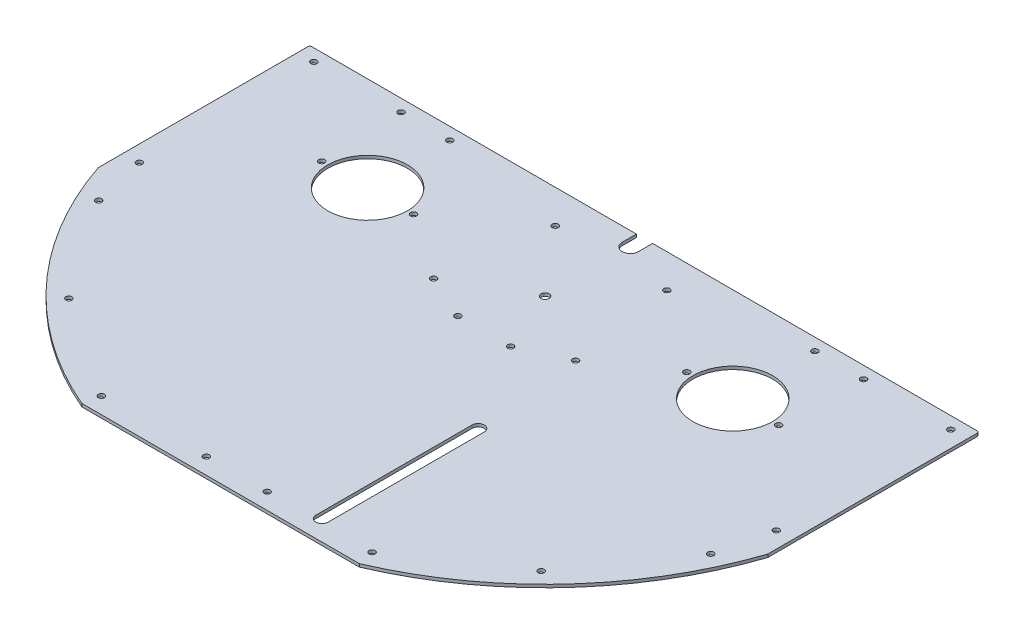
from build123d import *

# Parameters (mm, degrees)
BOSS_EXTRU_1_DEPTH      = 1.5
ESQUISSE7_R             = 1.5
ENL_V_MAT_EXTRU_5_DEPTH = 230.841793415
ESQUISSE8_R             = 19.627416998
ESQUISSE8_R_2           = 1.5
ENL_V_MAT_EXTRU_6_DEPTH = 230.841793415
ESQUISSE9_R             = 1.5
ESQUISSE9_R_2           = 2
ENL_V_MAT_EXTRU_7_DEPTH = 230.841793415
ENL_V_MAT_EXTRU_8_DEPTH = 230.841793415
CONG_1_R                = 1
ESQUISSE11_R            = 1.5
ENL_V_MAT_EXTRU_9_DEPTH = 230.841793415


with BuildPart() as part:
    # Esquisse1 → Boss.-Extru.1 (new body)
    with BuildSketch(Plane(origin=(0, 0, 0), x_dir=(1, 0, 0), z_dir=(0, 1, 0))):
        with BuildLine():
            Line((0, 49), (165, 49))
            Line((165, 49), (165, -55.235857919))
            ThreePointArc((165, -55.235857919), (127.908511428, -117.963607542), (68.381283989, -160))
            Line((68.381283989, -160), (0, -160))
            Line((0, -160), (0, 49))
        make_face()
    extrude(amount=BOSS_EXTRU_1_DEPTH)

    # Symétrie1: part across plane


with BuildPart() as part_1:
    add(part.part)
    add(part.part.mirror(Plane(origin=(0, 1.5, -49), x_dir=(0, 0, 1), z_dir=(1, 0, 0))))

    # Esquisse7 → Enlèv. mat.-Extru.5 (cut, through all)
    with BuildSketch(Plane(origin=(0, 1.5, 0), x_dir=(1, 0, 0), z_dir=(0, 1, 0))):
        with Locations(Location((-157, -43, 0), (0, 0, 270))):
            Circle(ESQUISSE7_R)
        with Locations(Location((157, -43, 0), (0, 0, 270))):
            Circle(ESQUISSE7_R)
        with Locations(Location((157, 43, 0), (0, 0, 270))):
            Circle(ESQUISSE7_R)
        with Locations(Location((-157, 43, 0), (0, 0, 270))):
            Circle(ESQUISSE7_R)
        with Locations(Location((-114, 43, 0), (0, 0, 270))):
            Circle(ESQUISSE7_R)
        with Locations(Location((-90, 43, 0), (0, 0, 270))):
            Circle(ESQUISSE7_R)
        with Locations(Location((90, 43, 0), (0, 0, 90))):
            Circle(ESQUISSE7_R)
        with Locations(Location((114, 43, 0), (0, 0, 90))):
            Circle(ESQUISSE7_R)
    extrude(amount=-ENL_V_MAT_EXTRU_5_DEPTH, mode=Mode.SUBTRACT)

    # Esquisse8 → Enlèv. mat.-Extru.6 (cut, through all)
    with BuildSketch(Plane(origin=(0, 1.5, 0), x_dir=(1, 0, 0), z_dir=(0, 1, 0))):
        with Locations(Location((-90, 2.5, 0), (0, 0, 270))):
            Circle(ESQUISSE8_R)
        with Locations(Location((-112.627416998, 2.5, 0), (0, 0, 270))):
            Circle(ESQUISSE8_R_2)
        with Locations(Location((-67.372583002, 2.5, 0), (0, 0, 270))):
            Circle(ESQUISSE8_R_2)
        with Locations(Location((112.627416998, 2.5, 0), (0, 0, 90))):
            Circle(ESQUISSE8_R_2)
        with Locations(Location((67.372583002, 2.5, 0), (0, 0, 90))):
            Circle(ESQUISSE8_R_2)
        with Locations(Location((90, 2.5, 0), (0, 0, 90))):
            Circle(ESQUISSE8_R)
    extrude(amount=-ENL_V_MAT_EXTRU_6_DEPTH, mode=Mode.SUBTRACT)

    # Esquisse9 → Enlèv. mat.-Extru.7 (cut, through all)
    with BuildSketch(Plane(origin=(0, 1.5, 0), x_dir=(1, 0, 0), z_dir=(0, 1, 0))):
        with Locations(Location((27.5, 32.5, 0), (0, 0, 270))):
            Circle(ESQUISSE9_R)
        with Locations(Location((-13, -30, 0), (0, 0, 270))):
            Circle(ESQUISSE9_R)
        with Locations(Location((35, -20, 0), (0, 0, 270))):
            Circle(ESQUISSE9_R)
        with Locations(Location((-27.5, 32.5, 0), (0, 0, 90))):
            Circle(ESQUISSE9_R)
        with Locations(Location((0, 0, 0), (0, 0, 270))):
            Circle(ESQUISSE9_R_2)
        with Locations(Location((-35, -20, 0), (0, 0, 90))):
            Circle(ESQUISSE9_R)
        with Locations(Location((13, -30, 0), (0, 0, 90))):
            Circle(ESQUISSE9_R)
        with BuildLine():
            Line((4, 49), (4, 42))
            ThreePointArc((4, 42), (0, 38), (-4, 42))
            Line((-4, 42), (-4, 49))
            ThreePointArc((-4, 49), (0, 53), (4, 49))
        make_face()
    extrude(amount=-ENL_V_MAT_EXTRU_7_DEPTH, mode=Mode.SUBTRACT)

    # Esquisse10 → Enlèv. mat.-Extru.8 (cut, through all)
    with BuildSketch(Plane(origin=(0, 1.5, 0), x_dir=(1, 0, 0), z_dir=(0, 1, 0))):
        with BuildLine():
            Line((43, -73), (43, -150))
            ThreePointArc((43, -150), (40, -153), (37, -150))
            Line((37, -150), (37, -73))
            ThreePointArc((37, -73), (40, -70), (43, -73))
        make_face()
    extrude(amount=-ENL_V_MAT_EXTRU_8_DEPTH, mode=Mode.SUBTRACT)

    # Congé1
    cong_1_edges = [part_1.edges().sort_by_distance(p)[0] for p in [
        (-165, 0.75, -49),
        (165, 0.75, -49),
    ]]
    fillet(cong_1_edges, radius=CONG_1_R)

    # Esquisse11 → Enlèv. mat.-Extru.9 (cut, through all)
    with BuildSketch(Plane(origin=(0, 1.5, 0), x_dir=(1, 0, 0), z_dir=(0, 1, 0))):
        with Locations(Location((-150.869773386, -69.240966765, 0), (0, 0, 270))):
            Circle(ESQUISSE11_R)
        with Locations(Location((-116.399964779, -118.351375994, 0), (0, 0, 270))):
            Circle(ESQUISSE11_R)
        with Locations(Location((-66.72330927, -152, 0), (0, 0, 270))):
            Circle(ESQUISSE11_R)
        with Locations(Location((66.72330927, -152, 0), (0, 0, 90))):
            Circle(ESQUISSE11_R)
        with Locations(Location((116.399964779, -118.351375994, 0), (0, 0, 90))):
            Circle(ESQUISSE11_R)
        with Locations(Location((150.869773386, -69.240966765, 0), (0, 0, 90))):
            Circle(ESQUISSE11_R)
        with Locations(Location((-15, -152, 0), (0, 0, 270))):
            Circle(ESQUISSE11_R)
        with Locations(Location((15, -152, 0), (0, 0, 90))):
            Circle(ESQUISSE11_R)
    extrude(amount=-ENL_V_MAT_EXTRU_9_DEPTH, mode=Mode.SUBTRACT)


solid = part_1.part
